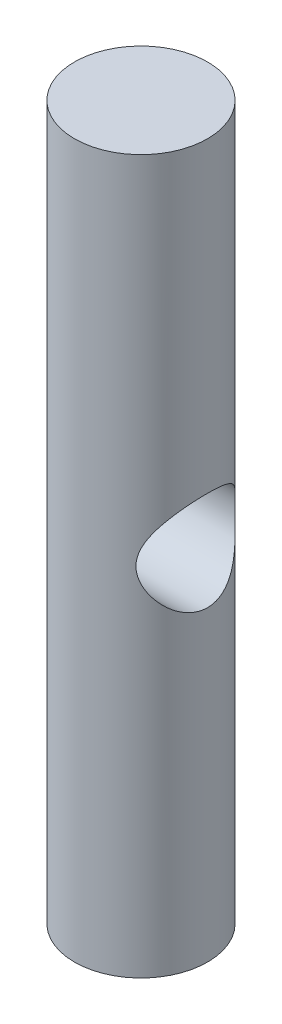
from build123d import *

# Parameters (mm, degrees)
SKETCH1_R               = 10.668
BOSS_EXTRUDE1_DEPTH     = 114.3
CUT_EXTRUDE1_DEPTH      = 116.291380632
CUT_EXTRUDE1_DEPTH_BACK = 116.291380632
SKETCH2_R               = 7.9375


with BuildPart() as part:
    # Sketch1 → Boss-Extrude1 (new body)
    with BuildSketch(Plane(origin=(0, 0, 0), x_dir=(1, 0, 0), z_dir=(0, 1, 0))):
        with Locations(Location((0, 0, 0), (0, 0, 270))):
            Circle(SKETCH1_R)
    extrude(amount=BOSS_EXTRUDE1_DEPTH)

    # Sketch2 → Cut-Extrude1 (cut, two sides: drawn at the far end of the back side and taken through both)
    with BuildSketch(Plane(origin=(0, 0, 0), x_dir=(0, 0, -1), z_dir=(1, 0, 0)).offset(-CUT_EXTRUDE1_DEPTH_BACK)):
        with Locations(Location((0, 57.15, 0), (0, 0, 180))):
            Circle(SKETCH2_R)
    extrude(amount=CUT_EXTRUDE1_DEPTH + CUT_EXTRUDE1_DEPTH_BACK, mode=Mode.SUBTRACT)


solid = part.part
